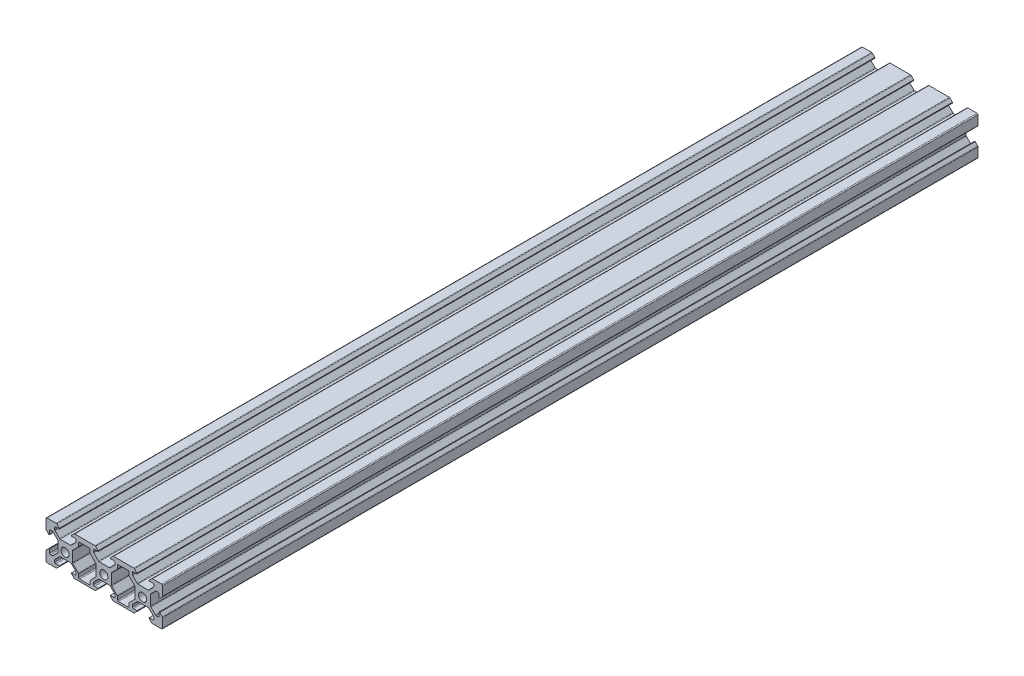
from build123d import *

# Parameters (mm, degrees)
SKETCH1_R           = 2.1
BOSS_EXTRUDE1_DEPTH = 420


with BuildPart() as part:
    # Sketch1 → Boss-Extrude1 (new body)
    with BuildSketch(Plane.XY):
        with BuildLine():
            Line((-22.409183164, -3.200852904), (-17.14471707, -3.200852904))
            ThreePointArc((-17.14471707, -3.200852904), (-16.953375354, -3.238913137), (-16.79116368, -3.347299513))
            Line((-16.79116368, -3.347299513), (-14.423396727, -5.715066466))
            ThreePointArc((-14.423396727, -5.715066466), (-14.315010351, -5.87727814), (-14.276950117, -6.068619857))
            Line((-14.276950117, -6.068619857), (-14.276950117, -7.000852904))
            ThreePointArc((-14.276950117, -7.000852904), (-14.423396727, -7.354406294), (-14.776950117, -7.500852904))
            Line((-14.776950117, -7.500852904), (-16.651950117, -7.500852904))
            Line((-16.651950117, -7.500852904), (-16.651950117, -7.845852904))
            Line((-16.651950117, -7.845852904), (-15.343396727, -9.154406294))
            ThreePointArc((-15.343396727, -9.154406294), (-15.181185052, -9.26279267), (-14.989843336, -9.300852904))
            Line((-14.989843336, -9.300852904), (-4.564056898, -9.300852904))
            ThreePointArc((-4.564056898, -9.300852904), (-4.372715182, -9.26279267), (-4.210503508, -9.154406294))
            Line((-4.210503508, -9.154406294), (-2.901950117, -7.845852904))
            Line((-2.901950117, -7.845852904), (-2.901950117, -7.500852904))
            Line((-2.901950117, -7.500852904), (-4.776950117, -7.500852904))
            ThreePointArc((-4.776950117, -7.500852904), (-5.130503508, -7.354406294), (-5.276950117, -7.000852904))
            Line((-5.276950117, -7.000852904), (-5.276950117, -6.068619857))
            ThreePointArc((-5.276950117, -6.068619857), (-5.238889883, -5.87727814), (-5.130503508, -5.715066466))
            Line((-5.130503508, -5.715066466), (-2.762736555, -3.347299513))
            ThreePointArc((-2.762736555, -3.347299513), (-2.60052488, -3.238913137), (-2.409183164, -3.200852904))
            Line((-2.409183164, -3.200852904), (2.85528293, -3.200852904))
            ThreePointArc((2.85528293, -3.200852904), (3.046624646, -3.238913137), (3.20883632, -3.347299513))
            Line((3.20883632, -3.347299513), (5.576603273, -5.715066466))
            ThreePointArc((5.576603273, -5.715066466), (5.684989649, -5.87727814), (5.723049883, -6.068619857))
            Line((5.723049883, -6.068619857), (5.723049883, -7.000852904))
            ThreePointArc((5.723049883, -7.000852904), (5.576603273, -7.354406294), (5.223049883, -7.500852904))
            Line((5.223049883, -7.500852904), (3.348049883, -7.500852904))
            Line((3.348049883, -7.500852904), (3.348049883, -7.845852904))
            Line((3.348049883, -7.845852904), (4.656603273, -9.154406294))
            ThreePointArc((4.656603273, -9.154406294), (4.818814948, -9.26279267), (5.010156664, -9.300852904))
            Line((5.010156664, -9.300852904), (15.435943102, -9.300852904))
            ThreePointArc((15.435943102, -9.300852904), (15.627284818, -9.26279267), (15.789496492, -9.154406294))
            Line((15.789496492, -9.154406294), (17.098049883, -7.845852904))
            Line((17.098049883, -7.845852904), (17.098049883, -7.500852904))
            Line((17.098049883, -7.500852904), (15.223049883, -7.500852904))
            ThreePointArc((15.223049883, -7.500852904), (14.869496492, -7.354406294), (14.723049883, -7.000852904))
            Line((14.723049883, -7.000852904), (14.723049883, -6.068619857))
            ThreePointArc((14.723049883, -6.068619857), (14.761110117, -5.87727814), (14.869496492, -5.715066466))
            Line((14.869496492, -5.715066466), (17.237263445, -3.347299513))
            ThreePointArc((17.237263445, -3.347299513), (17.39947512, -3.238913137), (17.590816836, -3.200852904))
            Line((17.590816836, -3.200852904), (22.85528293, -3.200852904))
            ThreePointArc((22.85528293, -3.200852904), (23.046624646, -3.238913137), (23.20883632, -3.347299513))
            Line((23.20883632, -3.347299513), (25.576603273, -5.715066466))
            ThreePointArc((25.576603273, -5.715066466), (25.684989649, -5.87727814), (25.723049883, -6.068619857))
            Line((25.723049883, -6.068619857), (25.723049883, -7.000852904))
            ThreePointArc((25.723049883, -7.000852904), (25.576603273, -7.354406294), (25.223049883, -7.500852904))
            Line((25.223049883, -7.500852904), (23.348049883, -7.500852904))
            Line((23.348049883, -7.500852904), (23.348049883, -7.845852904))
            Line((23.348049883, -7.845852904), (24.656603273, -9.154406294))
            ThreePointArc((24.656603273, -9.154406294), (24.818814948, -9.26279267), (25.010156664, -9.300852904))
            Line((25.010156664, -9.300852904), (29.723049883, -9.300852904))
            ThreePointArc((29.723049883, -9.300852904), (30.076603273, -9.154406294), (30.223049883, -8.800852904))
            Line((30.223049883, -8.800852904), (30.223049883, -4.087959685))
            ThreePointArc((30.223049883, -4.087959685), (30.184989649, -3.896617969), (30.076603273, -3.734406294))
            Line((30.076603273, -3.734406294), (28.768049883, -2.425852904))
            Line((28.768049883, -2.425852904), (28.423049883, -2.425852904))
            Line((28.423049883, -2.425852904), (28.423049883, -4.300852904))
            ThreePointArc((28.423049883, -4.300852904), (28.276603273, -4.654406294), (27.923049883, -4.800852904))
            Line((27.923049883, -4.800852904), (26.990816836, -4.800852904))
            ThreePointArc((26.990816836, -4.800852904), (26.79947512, -4.76279267), (26.637263445, -4.654406294))
            Line((26.637263445, -4.654406294), (24.269496492, -2.286639341))
            ThreePointArc((24.269496492, -2.286639341), (24.161110117, -2.124427667), (24.123049883, -1.933085951))
            Line((24.123049883, -1.933085951), (24.123049883, 3.331380143))
            ThreePointArc((24.123049883, 3.331380143), (24.161110117, 3.52272186), (24.269496492, 3.684933534))
            Line((24.269496492, 3.684933534), (26.637263445, 6.052700487))
            ThreePointArc((26.637263445, 6.052700487), (26.79947512, 6.161086863), (26.990816836, 6.199147096))
            Line((26.990816836, 6.199147096), (27.923049883, 6.199147096))
            ThreePointArc((27.923049883, 6.199147096), (28.276603273, 6.052700487), (28.423049883, 5.699147096))
            Line((28.423049883, 5.699147096), (28.423049883, 3.824147096))
            Line((28.423049883, 3.824147096), (28.768049883, 3.824147096))
            Line((28.768049883, 3.824147096), (30.076603273, 5.132700487))
            ThreePointArc((30.076603273, 5.132700487), (30.184989649, 5.294912161), (30.223049883, 5.486253878))
            Line((30.223049883, 5.486253878), (30.223049883, 10.199147096))
            ThreePointArc((30.223049883, 10.199147096), (30.076603273, 10.552700487), (29.723049883, 10.699147096))
            Line((29.723049883, 10.699147096), (25.010156664, 10.699147096))
            ThreePointArc((25.010156664, 10.699147096), (24.818814948, 10.661086863), (24.656603273, 10.552700487))
            Line((24.656603273, 10.552700487), (23.348049883, 9.244147096))
            Line((23.348049883, 9.244147096), (23.348049883, 8.899147096))
            Line((23.348049883, 8.899147096), (25.223049883, 8.899147096))
            ThreePointArc((25.223049883, 8.899147096), (25.576603273, 8.752700487), (25.723049883, 8.399147096))
            Line((25.723049883, 8.399147096), (25.723049883, 7.466914049))
            ThreePointArc((25.723049883, 7.466914049), (25.684989649, 7.275572333), (25.576603273, 7.113360659))
            Line((25.576603273, 7.113360659), (23.20883632, 4.745593706))
            ThreePointArc((23.20883632, 4.745593706), (23.046624646, 4.63720733), (22.85528293, 4.599147096))
            Line((22.85528293, 4.599147096), (17.590816836, 4.599147096))
            ThreePointArc((17.590816836, 4.599147096), (17.39947512, 4.63720733), (17.237263445, 4.745593706))
            Line((17.237263445, 4.745593706), (14.869496492, 7.113360659))
            ThreePointArc((14.869496492, 7.113360659), (14.761110117, 7.275572333), (14.723049883, 7.466914049))
            Line((14.723049883, 7.466914049), (14.723049883, 8.399147096))
            ThreePointArc((14.723049883, 8.399147096), (14.869496492, 8.752700487), (15.223049883, 8.899147096))
            Line((15.223049883, 8.899147096), (17.098049883, 8.899147096))
            Line((17.098049883, 8.899147096), (17.098049883, 9.244147096))
            Line((17.098049883, 9.244147096), (15.789496492, 10.552700487))
            ThreePointArc((15.789496492, 10.552700487), (15.627284818, 10.661086863), (15.435943102, 10.699147096))
            Line((15.435943102, 10.699147096), (5.010156664, 10.699147096))
            ThreePointArc((5.010156664, 10.699147096), (4.818814948, 10.661086863), (4.656603273, 10.552700487))
            Line((4.656603273, 10.552700487), (3.348049883, 9.244147096))
            Line((3.348049883, 9.244147096), (3.348049883, 8.899147096))
            Line((3.348049883, 8.899147096), (5.223049883, 8.899147096))
            ThreePointArc((5.223049883, 8.899147096), (5.576603273, 8.752700487), (5.723049883, 8.399147096))
            Line((5.723049883, 8.399147096), (5.723049883, 7.466914049))
            ThreePointArc((5.723049883, 7.466914049), (5.684989649, 7.275572333), (5.576603273, 7.113360659))
            Line((5.576603273, 7.113360659), (3.20883632, 4.745593706))
            ThreePointArc((3.20883632, 4.745593706), (3.046624646, 4.63720733), (2.85528293, 4.599147096))
            Line((2.85528293, 4.599147096), (-2.409183164, 4.599147096))
            ThreePointArc((-2.409183164, 4.599147096), (-2.60052488, 4.63720733), (-2.762736555, 4.745593706))
            Line((-2.762736555, 4.745593706), (-5.130503508, 7.113360659))
            ThreePointArc((-5.130503508, 7.113360659), (-5.238889883, 7.275572333), (-5.276950117, 7.466914049))
            Line((-5.276950117, 7.466914049), (-5.276950117, 8.399147096))
            ThreePointArc((-5.276950117, 8.399147096), (-5.130503508, 8.752700487), (-4.776950117, 8.899147096))
            Line((-4.776950117, 8.899147096), (-2.901950117, 8.899147096))
            Line((-2.901950117, 8.899147096), (-2.901950117, 9.244147096))
            Line((-2.901950117, 9.244147096), (-4.210503508, 10.552700487))
            ThreePointArc((-4.210503508, 10.552700487), (-4.372715182, 10.661086863), (-4.564056898, 10.699147096))
            Line((-4.564056898, 10.699147096), (-14.989843336, 10.699147096))
            ThreePointArc((-14.989843336, 10.699147096), (-15.181185052, 10.661086863), (-15.343396727, 10.552700487))
            Line((-15.343396727, 10.552700487), (-16.651950117, 9.244147096))
            Line((-16.651950117, 9.244147096), (-16.651950117, 8.899147096))
            Line((-16.651950117, 8.899147096), (-14.776950117, 8.899147096))
            ThreePointArc((-14.776950117, 8.899147096), (-14.423396727, 8.752700487), (-14.276950117, 8.399147096))
            Line((-14.276950117, 8.399147096), (-14.276950117, 7.466914049))
            ThreePointArc((-14.276950117, 7.466914049), (-14.315010351, 7.275572333), (-14.423396727, 7.113360659))
            Line((-14.423396727, 7.113360659), (-16.79116368, 4.745593706))
            ThreePointArc((-16.79116368, 4.745593706), (-16.953375354, 4.63720733), (-17.14471707, 4.599147096))
            Line((-17.14471707, 4.599147096), (-22.409183164, 4.599147096))
            ThreePointArc((-22.409183164, 4.599147096), (-22.60052488, 4.63720733), (-22.762736555, 4.745593706))
            Line((-22.762736555, 4.745593706), (-25.130503508, 7.113360659))
            ThreePointArc((-25.130503508, 7.113360659), (-25.238889883, 7.275572333), (-25.276950117, 7.466914049))
            Line((-25.276950117, 7.466914049), (-25.276950117, 8.399147096))
            ThreePointArc((-25.276950117, 8.399147096), (-25.130503508, 8.752700487), (-24.776950117, 8.899147096))
            Line((-24.776950117, 8.899147096), (-22.901950117, 8.899147096))
            Line((-22.901950117, 8.899147096), (-22.901950117, 9.244147096))
            Line((-22.901950117, 9.244147096), (-24.210503508, 10.552700487))
            ThreePointArc((-24.210503508, 10.552700487), (-24.372715182, 10.661086863), (-24.564056898, 10.699147096))
            Line((-24.564056898, 10.699147096), (-29.276950117, 10.699147096))
            ThreePointArc((-29.276950117, 10.699147096), (-29.630503508, 10.552700487), (-29.776950117, 10.199147096))
            Line((-29.776950117, 10.199147096), (-29.776950117, 5.486253878))
            ThreePointArc((-29.776950117, 5.486253878), (-29.738889883, 5.294912161), (-29.630503508, 5.132700487))
            Line((-29.630503508, 5.132700487), (-28.321950117, 3.824147096))
            Line((-28.321950117, 3.824147096), (-27.976950117, 3.824147096))
            Line((-27.976950117, 3.824147096), (-27.976950117, 5.699147096))
            ThreePointArc((-27.976950117, 5.699147096), (-27.830503508, 6.052700487), (-27.476950117, 6.199147096))
            Line((-27.476950117, 6.199147096), (-26.54471707, 6.199147096))
            ThreePointArc((-26.54471707, 6.199147096), (-26.353375354, 6.161086863), (-26.19116368, 6.052700487))
            Line((-26.19116368, 6.052700487), (-23.823396727, 3.684933534))
            ThreePointArc((-23.823396727, 3.684933534), (-23.715010351, 3.52272186), (-23.676950117, 3.331380143))
            Line((-23.676950117, 3.331380143), (-23.676950117, -1.933085951))
            ThreePointArc((-23.676950117, -1.933085951), (-23.715010351, -2.124427667), (-23.823396727, -2.286639341))
            Line((-23.823396727, -2.286639341), (-26.19116368, -4.654406294))
            ThreePointArc((-26.19116368, -4.654406294), (-26.353375354, -4.76279267), (-26.54471707, -4.800852904))
            Line((-26.54471707, -4.800852904), (-27.476950117, -4.800852904))
            ThreePointArc((-27.476950117, -4.800852904), (-27.830503508, -4.654406294), (-27.976950117, -4.300852904))
            Line((-27.976950117, -4.300852904), (-27.976950117, -2.425852904))
            Line((-27.976950117, -2.425852904), (-28.321950117, -2.425852904))
            Line((-28.321950117, -2.425852904), (-29.630503508, -3.734406294))
            ThreePointArc((-29.630503508, -3.734406294), (-29.738889883, -3.896617969), (-29.776950117, -4.087959685))
            Line((-29.776950117, -4.087959685), (-29.776950117, -8.800852904))
            ThreePointArc((-29.776950117, -8.800852904), (-29.630503508, -9.154406294), (-29.276950117, -9.300852904))
            Line((-29.276950117, -9.300852904), (-24.564056898, -9.300852904))
            ThreePointArc((-24.564056898, -9.300852904), (-24.372715182, -9.26279267), (-24.210503508, -9.154406294))
            Line((-24.210503508, -9.154406294), (-22.901950117, -7.845852904))
            Line((-22.901950117, -7.845852904), (-22.901950117, -7.500852904))
            Line((-22.901950117, -7.500852904), (-24.776950117, -7.500852904))
            ThreePointArc((-24.776950117, -7.500852904), (-25.130503508, -7.354406294), (-25.276950117, -7.000852904))
            Line((-25.276950117, -7.000852904), (-25.276950117, -6.068619857))
            ThreePointArc((-25.276950117, -6.068619857), (-25.238889883, -5.87727814), (-25.130503508, -5.715066466))
            Line((-25.130503508, -5.715066466), (-22.762736555, -3.347299513))
            ThreePointArc((-22.762736555, -3.347299513), (-22.60052488, -3.238913137), (-22.409183164, -3.200852904))
        make_face()
        with Locations((-20, 0)):
            Circle(SKETCH1_R, mode=Mode.SUBTRACT)
        Circle(SKETCH1_R, mode=Mode.SUBTRACT)
        with Locations((20, 0)):
            Circle(SKETCH1_R, mode=Mode.SUBTRACT)
        with BuildLine():
            Line((-13, 7.7), (-13, 6.146446609))
            ThreePointArc((-13, 6.146446609), (-13.038060234, 5.955104893), (-13.146446609, 5.792893219))
            Line((-13.146446609, 5.792893219), (-15.953553391, 2.985786438))
            ThreePointArc((-15.953553391, 2.985786438), (-16.061939766, 2.823574763), (-16.1, 2.632233047))
            Line((-16.1, 2.632233047), (-16.1, -2.632233047))
            ThreePointArc((-16.1, -2.632233047), (-16.061939766, -2.823574763), (-15.953553391, -2.985786438))
            Line((-15.953553391, -2.985786438), (-13.146446609, -5.792893219))
            ThreePointArc((-13.146446609, -5.792893219), (-13.038060234, -5.955104893), (-13, -6.146446609))
            Line((-13, -6.146446609), (-13, -7.7))
            ThreePointArc((-13, -7.7), (-12.853553391, -8.053553391), (-12.5, -8.2))
            Line((-12.5, -8.2), (-7.5, -8.2))
            ThreePointArc((-7.5, -8.2), (-7.146446609, -8.053553391), (-7, -7.7))
            Line((-7, -7.7), (-7, -6.146446609))
            ThreePointArc((-7, -6.146446609), (-6.961939766, -5.955104893), (-6.853553391, -5.792893219))
            Line((-6.853553391, -5.792893219), (-4.046446609, -2.985786438))
            ThreePointArc((-4.046446609, -2.985786438), (-3.938060234, -2.823574763), (-3.9, -2.632233047))
            Line((-3.9, -2.632233047), (-3.9, 2.632233047))
            ThreePointArc((-3.9, 2.632233047), (-3.938060234, 2.823574763), (-4.046446609, 2.985786438))
            Line((-4.046446609, 2.985786438), (-6.853553391, 5.792893219))
            ThreePointArc((-6.853553391, 5.792893219), (-6.961939766, 5.955104893), (-7, 6.146446609))
            Line((-7, 6.146446609), (-7, 7.7))
            ThreePointArc((-7, 7.7), (-7.146446609, 8.053553391), (-7.5, 8.2))
            Line((-7.5, 8.2), (-12.5, 8.2))
            ThreePointArc((-12.5, 8.2), (-12.853553391, 8.053553391), (-13, 7.7))
        make_face(mode=Mode.SUBTRACT)
        with BuildLine():
            Line((12.5, -8.2), (7.5, -8.2))
            ThreePointArc((7.5, -8.2), (7.146446609, -8.053553391), (7, -7.7))
            Line((7, -7.7), (7, -6.146446609))
            ThreePointArc((7, -6.146446609), (6.961939766, -5.955104893), (6.853553391, -5.792893219))
            Line((6.853553391, -5.792893219), (4.046446609, -2.985786438))
            ThreePointArc((4.046446609, -2.985786438), (3.938060234, -2.823574763), (3.9, -2.632233047))
            Line((3.9, -2.632233047), (3.9, 2.632233047))
            ThreePointArc((3.9, 2.632233047), (3.938060234, 2.823574763), (4.046446609, 2.985786438))
            Line((4.046446609, 2.985786438), (6.853553391, 5.792893219))
            ThreePointArc((6.853553391, 5.792893219), (6.961939766, 5.955104893), (7, 6.146446609))
            Line((7, 6.146446609), (7, 7.7))
            ThreePointArc((7, 7.7), (7.146446609, 8.053553391), (7.5, 8.2))
            Line((7.5, 8.2), (12.5, 8.2))
            ThreePointArc((12.5, 8.2), (12.853553391, 8.053553391), (13, 7.7))
            Line((13, 7.7), (13, 6.146446609))
            ThreePointArc((13, 6.146446609), (13.038060234, 5.955104893), (13.146446609, 5.792893219))
            Line((13.146446609, 5.792893219), (15.953553391, 2.985786438))
            ThreePointArc((15.953553391, 2.985786438), (16.061939766, 2.823574763), (16.1, 2.632233047))
            Line((16.1, 2.632233047), (16.1, -2.632233047))
            ThreePointArc((16.1, -2.632233047), (16.061939766, -2.823574763), (15.953553391, -2.985786438))
            Line((15.953553391, -2.985786438), (13.146446609, -5.792893219))
            ThreePointArc((13.146446609, -5.792893219), (13.038060234, -5.955104893), (13, -6.146446609))
            Line((13, -6.146446609), (13, -7.7))
            ThreePointArc((13, -7.7), (12.853553391, -8.053553391), (12.5, -8.2))
        make_face(mode=Mode.SUBTRACT)
    extrude(amount=BOSS_EXTRUDE1_DEPTH)


solid = part.part
